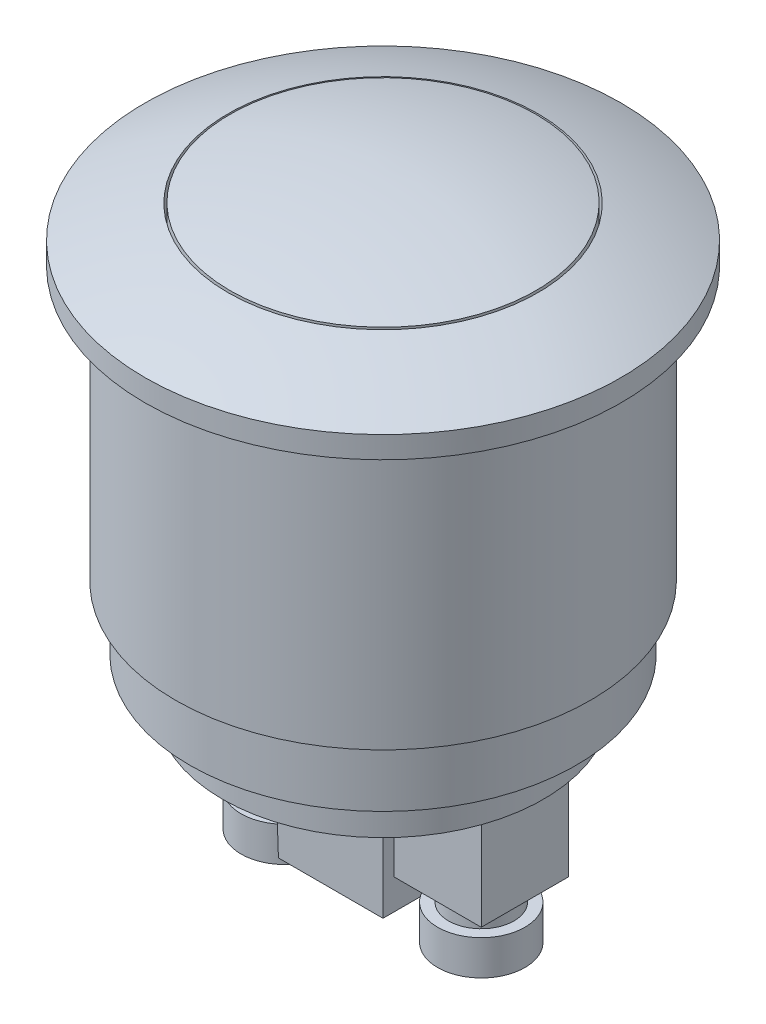
from build123d import *

# Parameters (mm, degrees)
SKETCH_1_R          = 10.9
EXTRUDE_1_DEPTH     = 1
DOME_1_FACE_RADIUS  = 10.9
DOME_1_HEIGHT       = 2.5
SKETCH_2_R          = 9.5
EXTRUDE_2_DEPTH     = 12.5
SKETCH_3_R          = 8.85
EXTRUDE_3_DEPTH     = 15.4
SKETCH_4_R          = 7.35
EXTRUDE_4_DEPTH     = 17.5
EXTRUDE_START       = -17.5
SKETCH_6_W          = 5
SKETCH_6_H          = 5
EXTRUDE_5_DEPTH     = 6
EXTRUDE_5_DRAFT     = -1
SKETCH_7_W          = 4
SKETCH_7_H          = 4
EXTRUDE_6_DEPTH     = 4.5
EXTRUDE_START_2     = -22
SKETCH_8_R          = 1.5
EXTRUDE_7_DEPTH     = 1
EXTRUDE_START_3     = -23
SKETCH_9_R          = 2
EXTRUDE_11_DEPTH    = 1.6
CUT_EXTRUDE_START   = 5
SKETCH_5_R          = 7.1
SKETCH_5_R_2        = 7
CUT_EXTRUDE_1_DEPTH = 15


with BuildPart() as part:
    # Эскиз1 → Бобышка-Вытянуть1 (new body)
    with BuildSketch(Plane(origin=(0, 0, 0), x_dir=(1, 0, 0), z_dir=(0, 1, 0))):
        with Locations(Location((0, 0, 0), (0, 0, 270))):
            Circle(SKETCH_1_R)
    extrude(amount=EXTRUDE_1_DEPTH)

    # Купол1: a dome of height H over a round flat face of radius A is a cap of a sphere of radius (A * A + H * H) / (2 * H)
    dome_1_r = (DOME_1_FACE_RADIUS * DOME_1_FACE_RADIUS + DOME_1_HEIGHT * DOME_1_HEIGHT) / (2 * DOME_1_HEIGHT)
    dome_1_base = Plane((0, 1, 0), z_dir=(0, 1, 0))
    with Locations(dome_1_base.offset(DOME_1_HEIGHT - dome_1_r)):
        dome_1_ball = Sphere(dome_1_r, mode=Mode.PRIVATE)
    add(split(dome_1_ball, bisect_by=dome_1_base, keep=Keep.TOP, mode=Mode.PRIVATE))

    # Эскиз2 → Бобышка-Вытянуть2 (add)
    with BuildSketch(Plane(origin=(0, 0, 0), x_dir=(1, 0, 0), z_dir=(0, 1, 0))):
        with Locations(Location((0, 0, 0), (0, 0, 270))):
            Circle(SKETCH_2_R)
    extrude(amount=-EXTRUDE_2_DEPTH)

    # Эскиз3 → Бобышка-Вытянуть3 (add)
    with BuildSketch(Plane(origin=(0, 0, 0), x_dir=(1, 0, 0), z_dir=(0, 1, 0))):
        with Locations(Location((0, 0, 0), (0, 0, 270))):
            Circle(SKETCH_3_R)
    extrude(amount=-EXTRUDE_3_DEPTH)

    # Эскиз4 → Бобышка-Вытянуть4 (add)
    with BuildSketch(Plane(origin=(0, 0, 0), x_dir=(1, 0, 0), z_dir=(0, 1, 0))):
        with Locations(Location((0, 0, 0), (0, 0, 270))):
            Circle(SKETCH_4_R)
    extrude(amount=-EXTRUDE_4_DEPTH)


with BuildPart() as extrude_5_tool:
    # Эскиз6 → Бобышка-Вытянуть5 (with draft: the straight prism first)
    with BuildSketch(Plane(origin=(0, 0, 0), x_dir=(1, 0, 0), z_dir=(0, 1, 0)).offset(EXTRUDE_START)):
        Rectangle(SKETCH_6_W, SKETCH_6_H)
    extrude(amount=-EXTRUDE_5_DEPTH)
    # Бобышка-Вытянуть5: the draft: its side faces are tilted about the plane it starts from
    extrude_5_sides = [extrude_5_tool.faces().sort_by_distance(p)[0] for p in [
        (0, -20.5, 2.5),
        (2.5, -20.5, 0),
        (0, -20.5, -2.5),
        (-2.5, -20.5, 0),
    ]]
    draft(extrude_5_sides, Plane(origin=(0, 0, 0), x_dir=(1, 0, 0), z_dir=(0, 1, 0)).offset(EXTRUDE_START), EXTRUDE_5_DRAFT)


with BuildPart() as part_1:
    add(part.part)

    # Бобышка-Вытянуть5: add extrude_5_tool
    add(extrude_5_tool.part)

    # Эскиз7 → Бобышка-Вытянуть6 (add)
    with BuildSketch(Plane(origin=(0, 0, 0), x_dir=(1, 0, 0), z_dir=(0, 1, 0)).offset(EXTRUDE_START)):
        with Locations((-4.5, 0)):
            Rectangle(SKETCH_7_W, SKETCH_7_H)
    extrude_6 = extrude(amount=-EXTRUDE_6_DEPTH)

    # Зеркальное отражение1: Бобышка-Вытянуть6 across plane
    add(extrude_6.mirror(Plane(origin=(0, 0, 0), x_dir=(0, 0, 1), z_dir=(1, 0, 0))))

    # Эскиз8 → Бобышка-Вытянуть7 (add)
    with BuildSketch(Plane(origin=(0, 0, 0), x_dir=(1, 0, 0), z_dir=(0, 1, 0)).offset(EXTRUDE_START_2)):
        with Locations(Location((-4.5, 0, 0), (0, 0, 270))):
            Circle(SKETCH_8_R)
    extrude_7 = extrude(amount=-EXTRUDE_7_DEPTH)

    # Эскиз9 → Бобышка-Вытянуть11 (add)
    with BuildSketch(Plane(origin=(0, 0, 0), x_dir=(1, 0, 0), z_dir=(0, 1, 0)).offset(EXTRUDE_START_3)):
        with Locations(Location((-4.5, 0, 0), (0, 0, 270))):
            Circle(SKETCH_9_R)
    extrude_11 = extrude(amount=-EXTRUDE_11_DEPTH)

    # Зеркальное отражение3: Бобышка-Вытянуть7, Бобышка-Вытянуть11 across plane
    add(extrude_7.mirror(Plane(origin=(0, 0, 0), x_dir=(0, 0, 1), z_dir=(1, 0, 0))))
    add(extrude_11.mirror(Plane(origin=(0, 0, 0), x_dir=(0, 0, 1), z_dir=(1, 0, 0))))

    # Эскиз5 → Вырез-Вытянуть1 (cut)
    with BuildSketch(Plane(origin=(0, 0, 0), x_dir=(1, 0, 0), z_dir=(0, 1, 0)).offset(CUT_EXTRUDE_START)):
        with Locations(Location((0, 0, 0), (0, 0, 270))):
            Circle(SKETCH_5_R)
        with Locations(Location((0, 0, 0), (0, 0, 270))):
            Circle(SKETCH_5_R_2, mode=Mode.SUBTRACT)
    extrude(amount=-CUT_EXTRUDE_1_DEPTH, mode=Mode.SUBTRACT)


solid = part_1.part
